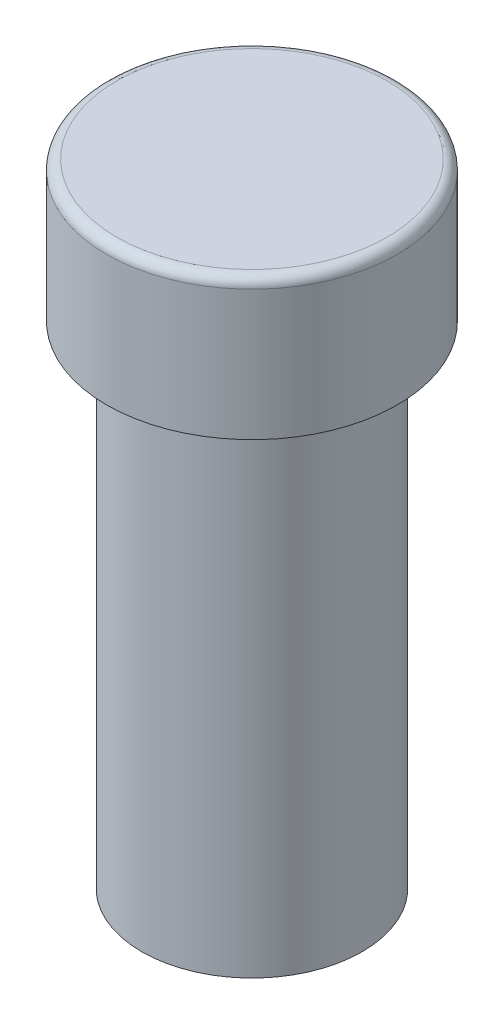
from build123d import *

# Parameters (mm, degrees)
SKETCH_2_R      = 14.5
EXTRUDE_1_DEPTH = 14
SKETCH_3_R      = 11
EXTRUDE_2_DEPTH = 49
FILLET_1_R      = 1


with BuildPart() as part:
    # 草图2 → 凸台-拉伸1 (new body)
    with BuildSketch(Plane(origin=(0, 0, 0), x_dir=(1, 0, 0), z_dir=(0, 1, 0))):
        with Locations(Location((0, 0, 0), (0, 0, 270))):
            Circle(SKETCH_2_R)
    extrude(amount=EXTRUDE_1_DEPTH)

    # 草图3 → 凸台-拉伸2 (add)
    with BuildSketch(Plane.XZ):
        with Locations(Location((0, 0, 0), (0, 0, 90))):
            Circle(SKETCH_3_R)
    extrude(amount=EXTRUDE_2_DEPTH)

    # 圆角1
    fillet_1_edges = [part.edges().sort_by_distance(p)[0] for p in [
        (0, 14, -14.5),
    ]]
    fillet(fillet_1_edges, radius=FILLET_1_R)


solid = part.part
